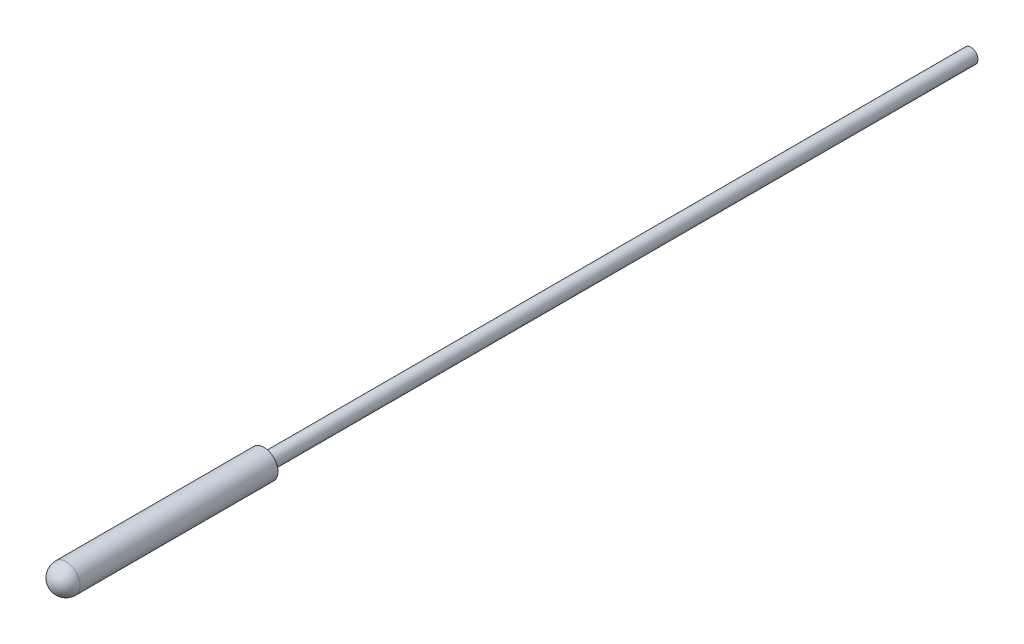
from build123d import *

# Parameters (mm, degrees)
SKETCH1_R           = 2
BOSS_EXTRUDE1_DEPTH = 30
FILLET1_R           = 2
SKETCH2_R           = 1.014585346
BOSS_EXTRUDE2_DEPTH = 100


with BuildPart() as part:
    # Sketch1 → Boss-Extrude1 (new body)
    with BuildSketch(Plane.XY):
        Circle(SKETCH1_R)
    extrude(amount=BOSS_EXTRUDE1_DEPTH)

    # Fillet1
    fillet1_edges = [part.edges().sort_by_distance(p)[0] for p in [
        (-2, 0, 30),
    ]]
    fillet(fillet1_edges, radius=FILLET1_R)

    # Sketch2 → Boss-Extrude2 (add)
    with BuildSketch(Plane(origin=(0, 0, 0), x_dir=(-1, 0, 0), z_dir=(0, 0, -1))):
        Circle(SKETCH2_R)
    extrude(amount=BOSS_EXTRUDE2_DEPTH)


solid = part.part
